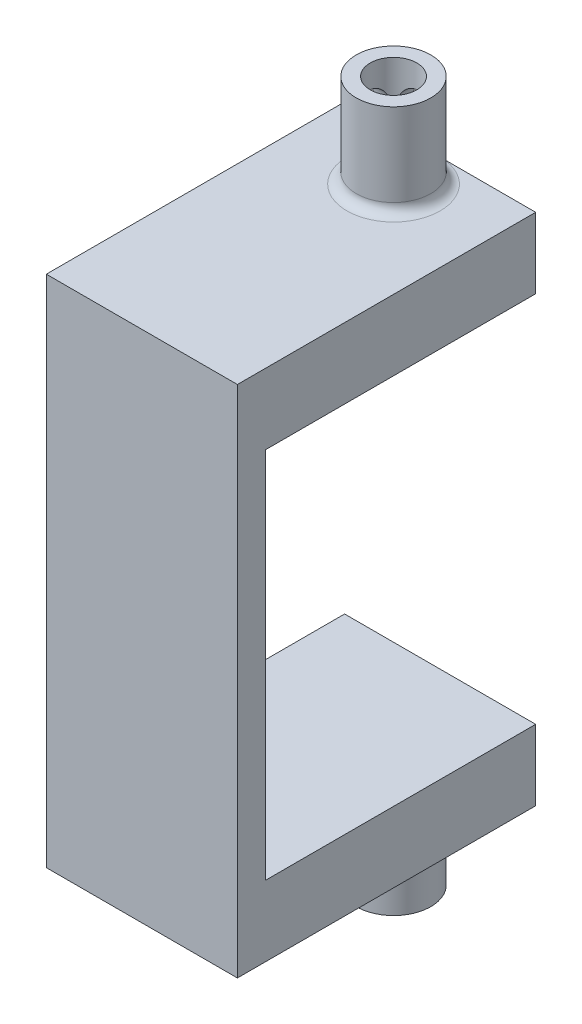
from build123d import *

# Parameters (mm, degrees)
SKETCH_1_R          = 2.000000000000001
EXTRUDE_1_DEPTH     = 29
SKETCH_2_W          = 20.5
SKETCH_2_H          = 70.28340969233892
EXTRUDE_2_DEPTH     = 3
SKETCH_3_W          = 20.5
SKETCH_3_H          = 7.570852423084727
CUT_EXTRUDE_1_DEPTH = 49.62100286394029
SKETCH_5_R          = 2.5
EXTRUDE_3_DEPTH     = 10
CUT_EXTRUDE_2_REACH = 75.297
SKETCH_8_R          = 1.6000000000000003
SKETCH_9_W          = 20.5
SKETCH_9_H          = 32
CUT_EXTRUDE_3_DEPTH = 65.57298284377197
SKETCH_12_W         = 20.499999999999996
SKETCH_12_H         = 7.57085242308473
SKETCH_12_R         = 2.0000000000000018
SKETCH_12_R_2       = 2.000000000000001
EXTRUDE_5_DEPTH     = 30
EXTRUDE_6_DEPTH     = 10
SKETCH_16_R         = 1.5000000000000004
CUT_EXTRUDE_5_DEPTH = 48.388093987806805
SKETCH_17_R         = 1.5000000000000004
CUT_EXTRUDE_6_DEPTH = 51.404676958704755
EXTRUDE_START       = 10
SKETCH_19_R         = 4
SKETCH_19_R_2       = 2.5000000000000004
EXTRUDE_7_DEPTH     = 10
SKETCH_21_R         = 1.5000000000000004
CUT_EXTRUDE_7_DEPTH = 48.38809406709012
SKETCH_22_R         = 1.5000000000000004
CUT_EXTRUDE_8_DEPTH = 51.404676958704755


with BuildPart() as part:
    # 草图1 → 凸台-拉伸1 (new body)
    # profile 1 of 3: a face of its own
    with BuildSketch(Plane.XY):
        with BuildLine():
            Line((-10.250000000000004, 35.14170484616946), (-10.250000000000004, 20))
            Line((-10.25, 20.000000000000004), (-4.999999999999999, 20.000000000000004))
            Line((-4.999999999999999, 20.000000000000004), (-4.999999999999999, 23.000000000000004))
            ThreePointArc((-5.000000000000001, 23.000000000000004), (-6.414213562373094, 26.4142135623731), (-2.9999999999999982, 25.000000000000004))
            Line((-2.9999999999999982, 25.000000000000004), (3, 25.000000000000004))
            ThreePointArc((3, 25.000000000000004), (5.000000000000001, 27.000000000000004), (7.000000000000002, 25.000000000000004))
            ThreePointArc((7.000000000000002, 25.000000000000004), (6.414213562373095, 23.585786437626908), (4.999999999999999, 23.000000000000004))
            Line((5.000000000000001, 23.000000000000004), (5.000000000000001, 20.000000000000004))
            Line((5, 20.000000000000004), (10.249999999999996, 20.000000000000004))
            Line((10.249999999999996, 20), (10.249999999999996, 35.14170484616946))
            Line((10.249999999999996, 35.14170484616946), (-10.250000000000004, 35.14170484616946))
        make_face()
    # profile 2 of 3: a face of its own
    with BuildSketch(Plane.XY):
        Polygon((10.249999999999996, -20), (-10.25, -20), (-10.250000000000004, -35.14170484616946), (10.249999999999996, -35.14170484616946), align=None)
        with Locations(Location((-4.999999999999999, -25.000000000000004, 0), (0, 0, 180))):
            Circle(SKETCH_1_R, mode=Mode.SUBTRACT)
        with Locations(Location((5.000000000000001, -25.000000000000004, 0), (0, 0, 180))):
            Circle(SKETCH_1_R, mode=Mode.SUBTRACT)
    # profile 3 of 3: a face of its own
    with BuildSketch(Plane.XY):
        with BuildLine():
            Line((-4.999999999999999, 23.000000000000004), (-4.999999999999999, 20.000000000000004))
            Line((-4.999999999999999, 20.000000000000004), (5, 20.000000000000004))
            Line((5.000000000000001, 20.000000000000004), (5.000000000000001, 23.000000000000004))
            ThreePointArc((4.999999999999999, 23.000000000000004), (3.585786437626904, 23.585786437626908), (3, 25.000000000000004))
            Line((3, 25.000000000000004), (-2.9999999999999982, 25.000000000000004))
            ThreePointArc((-2.9999999999999982, 25.000000000000004), (-3.585786437626905, 23.585786437626908), (-5.000000000000001, 23.000000000000004))
        make_face()
    extrude(amount=EXTRUDE_1_DEPTH)

    # 草图2 → 凸台-拉伸2 (add)
    with BuildSketch(Plane.XY.offset(29)):
        Rectangle(SKETCH_2_W, SKETCH_2_H)
    extrude(amount=EXTRUDE_2_DEPTH)

    # 草图3 → 切除-拉伸1 (cut, through all)
    with BuildSketch(Plane(origin=(0, 0, 0), x_dir=(-1, 0, 0), z_dir=(0, 0, -1))):
        with Locations((3.55e-15, -31.356278634627095)):
            Rectangle(SKETCH_3_W, SKETCH_3_H)
        Polygon((-10.249999999999996, 35.14170484616946), (-10.249999999999996, 27.57085242308473), (10.250000000000004, 27.570852423084734), (10.250000000000004, 35.14170484616946), align=None)
    extrude(amount=-CUT_EXTRUDE_1_DEPTH, mode=Mode.SUBTRACT)

    # 草图5 → 凸台-拉伸3 (add)
    with BuildSketch(Plane.XZ.offset(27.570852423084734)):
        with Locations(Location((0, 2.5, 0), (0, 0, 270))):
            Circle(SKETCH_5_R)
    extrude(amount=EXTRUDE_3_DEPTH)

    # 草图8 → 切除-拉伸2 (cut, up to next)
    with BuildSketch(Plane(origin=(0, 27.570852423084734, 0), x_dir=(1, 0, 0), z_dir=(0, 1, 0)), mode=Mode.PRIVATE) as cut_extrude_2_sk1:
        with Locations(Location((1.71e-15, -16.5, 0), (0, 0, 270))):
            Circle(SKETCH_8_R)
    cut_extrude_2_tool1 = extrude(cut_extrude_2_sk1.sketch, amount=-CUT_EXTRUDE_2_REACH, mode=Mode.PRIVATE) & part.part
    # 草图8 → 切除-拉伸2 (cut, up to next)
    with BuildSketch(Plane(origin=(0, 27.570852423084734, 0), x_dir=(1, 0, 0), z_dir=(0, 1, 0)), mode=Mode.PRIVATE) as cut_extrude_2_sk2:
        with Locations(Location((1.22e-15, -26.500000000000004, 0), (0, 0, 270))):
            Circle(SKETCH_8_R)
    cut_extrude_2_tool2 = extrude(cut_extrude_2_sk2.sketch, amount=-CUT_EXTRUDE_2_REACH, mode=Mode.PRIVATE) & part.part
    add(cut_extrude_2_tool1.solids().sort_by_distance((0, 27.570852, 16.5))[0], mode=Mode.SUBTRACT)
    add(cut_extrude_2_tool2.solids().sort_by_distance((0, 27.570852, 26.5))[0], mode=Mode.SUBTRACT)

    # 草图9 → 切除-拉伸3 (cut, through all)
    with BuildSketch(Plane.XZ.offset(27.570852423084734)):
        with Locations((-3.55e-15, 16)):
            Rectangle(SKETCH_9_W, SKETCH_9_H)
    extrude(amount=CUT_EXTRUDE_3_DEPTH, mode=Mode.SUBTRACT)

    # 草图12 → 凸台-拉伸5 (add)
    with BuildSketch(Plane(origin=(0, 0, 0), x_dir=(-1, 0, 0), z_dir=(0, 0, -1))):
        with Locations((1.78e-15, 23.78542621154237)):
            Rectangle(SKETCH_12_W, SKETCH_12_H)
        with Locations((-5.000000000000001, 25.000000000000004)):
            Circle(SKETCH_12_R, mode=Mode.SUBTRACT)
        with Locations((4.999999999999999, 25.000000000000004)):
            Circle(SKETCH_12_R_2, mode=Mode.SUBTRACT)
    extrude(amount=-EXTRUDE_5_DEPTH)

    # 草图13 → 凸台-拉伸6 (add)
    with BuildSketch(Plane(origin=(0, 27.570852423084734, 0), x_dir=(1, 0, 0), z_dir=(0, 1, 0))):
        with BuildLine():
            ThreePointArc((4.456e-14, -7.5), (-2.5, -5.000000000000058), (-7.084e-14, -2.4999999999999996))
            Line((-1.4e-16, -2.4999999999999996), (-5e-17, -1))
            ThreePointArc((7.635e-14, -1), (-3.9999999999999996, -4.999999999999907), (-1.067e-13, -9))
            Line((-4.9e-16, -9), (-4.1e-16, -7.5))
        make_face()
        with BuildLine():
            Line((-5e-17, -1), (-1.4e-16, -2.4999999999999996))
            ThreePointArc((-7.084e-14, -2.4999999999999996), (1.7677669529663447, -3.2322330470336054), (2.500000000000001, -5))
            ThreePointArc((2.500000000000001, -5.000000000000001), (1.767766952966385, -6.767766952966354), (4.456e-14, -7.5))
            Line((-4.1e-16, -7.5), (-4.9e-16, -9))
            ThreePointArc((-1.067e-13, -9), (2.828427124746152, -7.828427124746229), (4.000000000000001, -5.000000000000001))
            ThreePointArc((4.000000000000001, -5), (2.8284271247462174, -2.171572875253837), (7.635e-14, -1))
        make_face()
    extrude(amount=EXTRUDE_6_DEPTH)

    # 草图15 → 旋转1 (revolve)
    with BuildSketch(Plane(origin=(0, 0, 0), x_dir=(0, 0, -1), z_dir=(1, 0, 0))):
        with BuildLine():
            Line((-1, 27.570852423084734), (0, 27.570852423084734))
            ThreePointArc((0, 27.570852423084734), (-0.7128919117369903, 27.930797461014013), (-1, 28.676011694509246))
            Line((-1, 28.676011694509246), (-1, 27.570852423084734))
        make_face()
    revolve(axis=Axis((0, -962.4291475769152, 4.99999999999657), (0, 1, 3.43e-15)))

    # 草图16 → 切除-拉伸5 (cut, through all)
    with BuildSketch(Plane.XY.offset(5)):
        with Locations(Location((4.9e-16, 33.57085242308473, 0), (0, 0, 90))):
            Circle(SKETCH_16_R)
    extrude(amount=-CUT_EXTRUDE_5_DEPTH, mode=Mode.SUBTRACT)

    # 草图17 → 切除-拉伸6 (cut, through all)
    with BuildSketch(Plane(origin=(0, 0, 0), x_dir=(0, 0, -1), z_dir=(1, 0, 0))):
        with Locations((-5, 33.57085242308473)):
            Circle(SKETCH_17_R)
    extrude(amount=-CUT_EXTRUDE_6_DEPTH, mode=Mode.SUBTRACT)

    # 草图19 → 凸台-拉伸7 (add)
    with BuildSketch(Plane.XZ.offset(27.570852423084734).offset(EXTRUDE_START)):
        with Locations(Location((0, 4.999999999999998, 0), (0, 0, 270))):
            Circle(SKETCH_19_R)
        with Locations(Location((0, 4.999999999999998, 0), (0, 0, 90))):
            Circle(SKETCH_19_R_2, mode=Mode.SUBTRACT)
    extrude(amount=-EXTRUDE_7_DEPTH)

    # 草图20 → 旋转2 (revolve)
    with BuildSketch(Plane(origin=(0, 0, 0), x_dir=(0, 0, -1), z_dir=(1, 0, 0))):
        with BuildLine():
            Line((-0.9999999999999983, -27.570852423084734), (0, -27.570852423084734))
            ThreePointArc((0, -27.570852423084734), (-0.7071067811865462, -27.863745641898188), (-0.9999999999999981, -28.570852423084734))
            Line((-0.9999999999999981, -28.570852423084734), (-0.9999999999999983, -27.570852423084734))
        make_face()
    revolve(axis=Axis((0, -1027.5708524230847, 4.999999999996567), (0, 1, 3.43e-15)))

    # 草图21 → 切除-拉伸7 (cut, through all)
    with BuildSketch(Plane.XY.offset(5)):
        with Locations((0, -33.57085242308473)):
            Circle(SKETCH_21_R)
    extrude(amount=-CUT_EXTRUDE_7_DEPTH, mode=Mode.SUBTRACT)

    # 草图22 → 切除-拉伸8 (cut, through all)
    with BuildSketch(Plane(origin=(0, 0, 0), x_dir=(0, 0, -1), z_dir=(1, 0, 0))):
        with Locations((-5, -33.57085242308473)):
            Circle(SKETCH_22_R)
    extrude(amount=-CUT_EXTRUDE_8_DEPTH, mode=Mode.SUBTRACT)


solid = part.part
